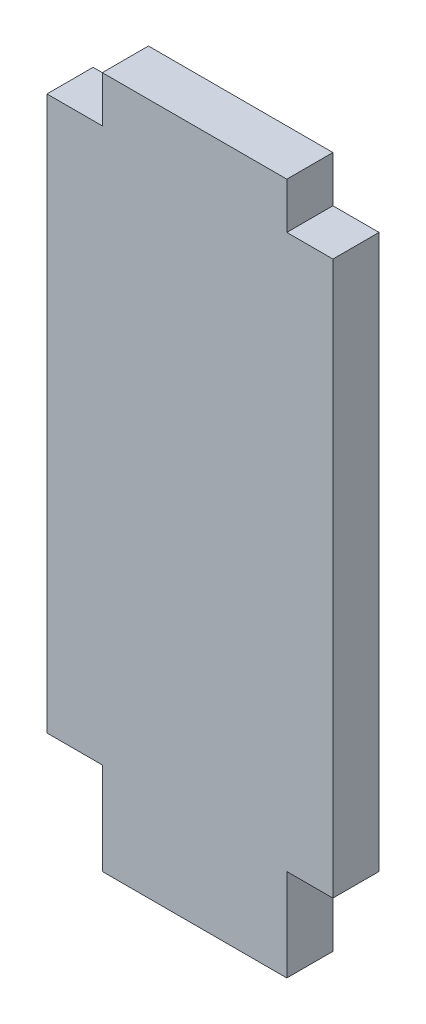
from build123d import *

# Parameters (mm, degrees)
BOSS_EXTRUDE1_DEPTH = 2.5


with BuildPart() as part:
    # Sketch1 → Boss-Extrude1 (new body)
    with BuildSketch(Plane.XY):
        Polygon((-7.75, 16.25), (-4.75, 16.25), (-4.75, 18.75), (5.25, 18.75), (5.25, 16.25), (7.75, 16.25), (7.75, -13.75), (5.25, -13.75), (5.25, -18.75), (-4.75, -18.75), (-4.75, -13.75), (-7.75, -13.75), align=None)
    extrude(amount=BOSS_EXTRUDE1_DEPTH)


solid = part.part
